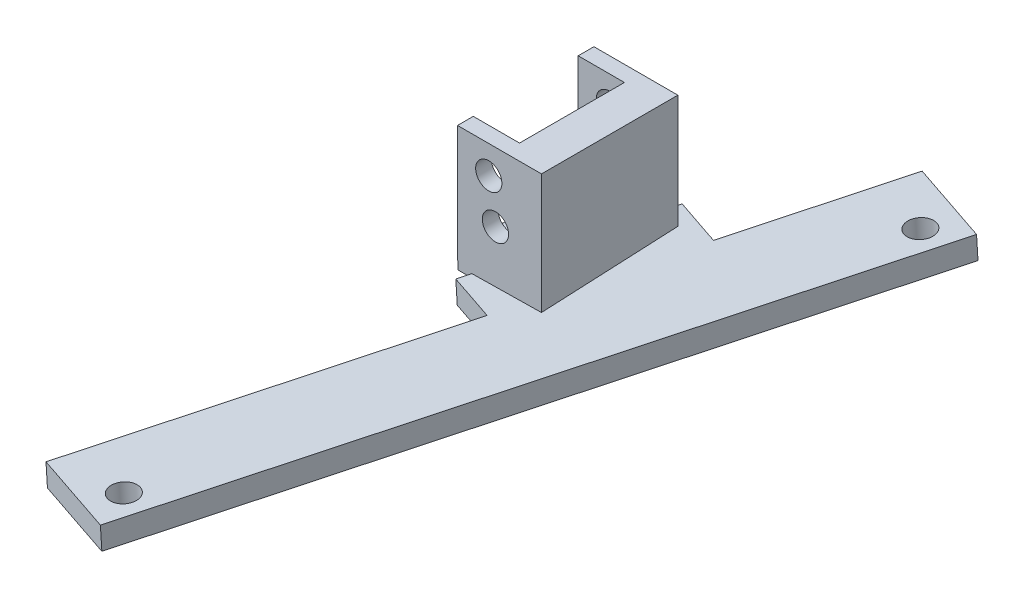
from build123d import *

# Parameters (mm, degrees)
BOSS_EXTRUDE1_DEPTH = 29.21
SKETCH2_R           = 3.175
BOSS_EXTRUDE2_DEPTH = 3.81
SKETCH3_R           = 3.175
BOSS_EXTRUDE3_DEPTH = 3.81
SKETCH4_R           = 3.175
BOSS_EXTRUDE4_DEPTH = 5.588
BOSS_EXTRUDE5_DEPTH = 33.02


with BuildPart() as part:
    # Sketch1 → Boss-Extrude1 (new body)
    with BuildSketch(Plane.XY):
        with BuildLine():
            Line((468.75530918, 278.776071532), (459.631228606, 278.776071532))
            ThreePointArc((459.631228606, 278.776071532), (460.543620658, 278.201967285), (461.366897066, 277.506071532))
            ThreePointArc((461.366897066, 277.506071532), (463.397272377, 274.114329254), (463.477224231, 270.162121354))
            ThreePointArc((463.477224231, 270.162121354), (463.399405765, 268.135304283), (464.120754615, 266.239598875))
            ThreePointArc((464.120754615, 266.239598875), (465.307742726, 262.469481888), (464.467858916, 258.607187485))
            ThreePointArc((464.467858916, 258.607187485), (462.151375158, 255.897407535), (458.862647092, 254.521445295))
            Line((458.862647092, 254.521445295), (448.43530918, 252.810420021))
            Line((448.43530918, 252.810420021), (448.43530918, 250.486101833))
            Line((448.43530918, 250.486101833), (468.75530918, 250.486101833))
            Line((468.75530918, 250.486101833), (468.75530918, 278.776071532))
        make_face()
    extrude(amount=-BOSS_EXTRUDE1_DEPTH)

    # Sketch2 → Boss-Extrude2 (add)
    with BuildSketch(Plane.XY):
        Polygon((448.43530918, 252.810420021), (448.43530918, 278.776071532), (468.75530918, 278.776071532), (468.75530918, 250.486101833), (448.43530918, 250.486101833), align=None)
        with Locations(Location((455.996603091, 271.987703521, 0), (0, 0, 180))):
            Circle(SKETCH2_R, mode=Mode.SUBTRACT)
        with Locations(Location((457.615851502, 262.119672583, 0), (0, 0, 180))):
            Circle(SKETCH2_R, mode=Mode.SUBTRACT)
    extrude(amount=BOSS_EXTRUDE2_DEPTH)

    # Sketch3 → Boss-Extrude3 (add)
    # profile 1 of 3: a face of its own
    with BuildSketch(Plane(origin=(0, 0, -25.4), x_dir=(-1, 0, 0), z_dir=(0, 0, -1))):
        with BuildLine():
            Line((-464.467858916, 258.607187485), (-448.43530918, 255.976401177))
            Line((-448.43530918, 255.976401177), (-448.43530918, 275.384123064))
            Line((-448.43530918, 275.384123064), (-461.366897066, 277.506071532))
            ThreePointArc((-461.366897066, 277.506071532), (-463.397272377, 274.114329254), (-463.477224231, 270.162121354))
            ThreePointArc((-463.477224231, 270.162121354), (-463.399405765, 268.135304283), (-464.120754615, 266.239598875))
            ThreePointArc((-464.120754615, 266.239598875), (-465.307742726, 262.469481888), (-464.467858916, 258.607187485))
        make_face()
        with Locations((-457.615851502, 262.119672583)):
            Circle(SKETCH3_R, mode=Mode.SUBTRACT)
        with Locations((-455.996603091, 271.987703521)):
            Circle(SKETCH3_R, mode=Mode.SUBTRACT)
    # profile 2 of 3: a face of its own
    with BuildSketch(Plane(origin=(0, 0, -25.4), x_dir=(-1, 0, 0), z_dir=(0, 0, -1))):
        with BuildLine():
            Line((-458.862647092, 254.521445295), (-448.43530918, 252.810420021))
            Line((-448.43530918, 252.810420021), (-448.43530918, 255.976401177))
            Line((-448.43530918, 255.976401177), (-464.467858916, 258.607187485))
            ThreePointArc((-464.467858916, 258.607187485), (-462.151375158, 255.897407535), (-458.862647092, 254.521445295))
        make_face()
    # profile 3 of 3: a face of its own
    with BuildSketch(Plane(origin=(0, 0, -25.4), x_dir=(-1, 0, 0), z_dir=(0, 0, -1))):
        with BuildLine():
            Line((-461.366897066, 277.506071532), (-448.43530918, 275.384123064))
            Line((-448.43530918, 275.384123064), (-448.43530918, 278.776071532))
            Line((-448.43530918, 278.776071532), (-459.631228606, 278.776071532))
            ThreePointArc((-459.631228606, 278.776071532), (-460.543620658, 278.201967285), (-461.366897066, 277.506071532))
        make_face()
    extrude(amount=BOSS_EXTRUDE3_DEPTH)

    # Sketch4 → Boss-Extrude4 (add)
    with BuildSketch(Plane(origin=(-3.84203447, 241.841104975, 11.406767954), x_dir=(0.9998741117550617, 0.015849347043774307, 0.0007475562269394091), z_dir=(-0.015866967007794316, 0.9987637706378837, 0.04710806533037044))):
        Polygon((459.215763784, -85.500450968), (512.667124492, 73.389830794), (492.808231658, 80.070446074), (480.07788451, 42.228033485), (468.640206694, 46.075716527), (454.8306113, 5.025115122), (466.268289117, 1.17743208), (439.35687095, -78.819835688), align=None)
        with Locations(Location((455.674707496, -76.269609027, 0), (0, 0, 270))):
            Circle(SKETCH4_R, mode=Mode.SUBTRACT)
        with Locations(Location((504.266853595, 68.176101666, 0), (0, 0, 270))):
            Circle(SKETCH4_R, mode=Mode.SUBTRACT)
    extrude(amount=-BOSS_EXTRUDE4_DEPTH)

    # Sketch5 → Boss-Extrude5 (add)
    with BuildSketch(Plane.XY.offset(3.81)):
        Polygon((468.75530918, 250.486101833), (448.560469366, 250.486101833), (448.560469366, 248.52896412), (468.75530918, 248.393245925), align=None)
    extrude(amount=-BOSS_EXTRUDE5_DEPTH)


solid = part.part
